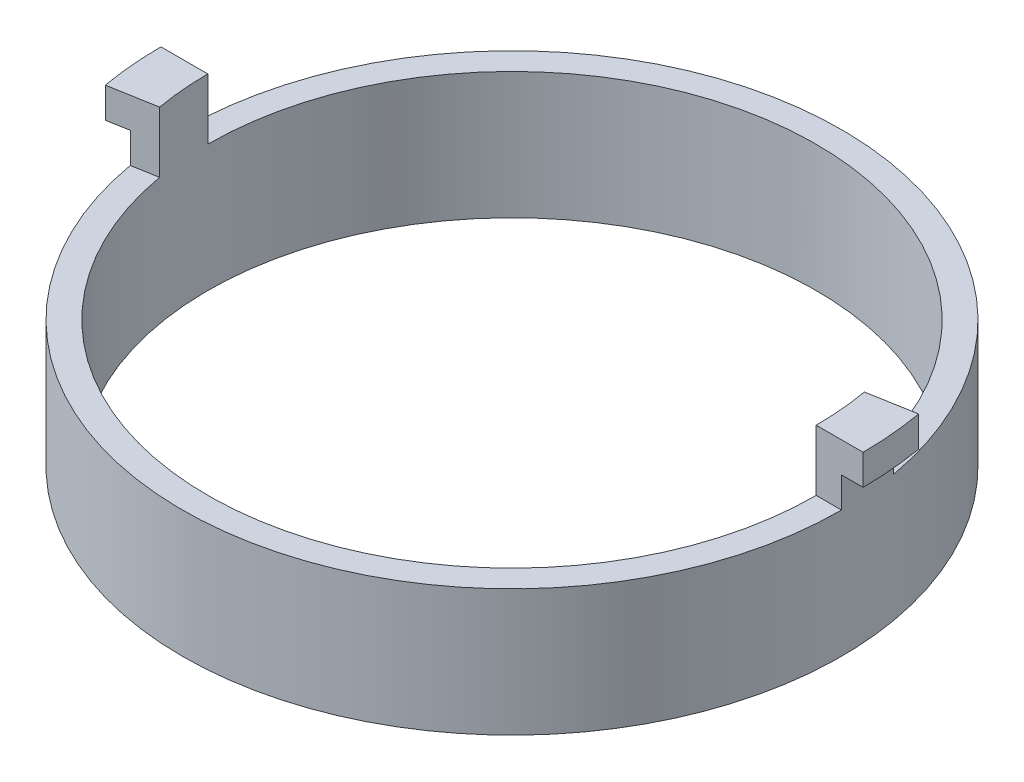
from build123d import *

# Parameters (mm, degrees)
SKETCH1_R           = 13
SKETCH1_R_2         = 12
BOSS_EXTRUDE1_DEPTH = 5
REVOLVE1_ANGLE      = 10


with BuildPart() as part:
    # Sketch1 → Boss-Extrude1 (new body)
    with BuildSketch(Plane(origin=(0, 0, 0), x_dir=(1, 0, 0), z_dir=(0, 1, 0))):
        with Locations(Location((0, 0, 0), (0, 0, 270))):
            Circle(SKETCH1_R)
        with Locations(Location((0, 0, 0), (0, 0, 270))):
            Circle(SKETCH1_R_2, mode=Mode.SUBTRACT)
    extrude(amount=BOSS_EXTRUDE1_DEPTH)

    # Sketch2 → Revolve1 (revolve)
    with BuildSketch(Plane.XY):
        Polygon((-13, 5), (-12, 5), (-12, 6.2), (-12, 7.4), (-13.85, 7.4), (-13.85, 6.2), (-13, 6.2), align=None)
        Polygon((12, 6.2), (12, 7.4), (13.85, 7.4), (13.85, 6.2), (13, 6.2), (13, 5), (12, 5), align=None)
    revolve(axis=Axis((0, 0, 0), (0, 1, 0)), revolution_arc=REVOLVE1_ANGLE)


solid = part.part
